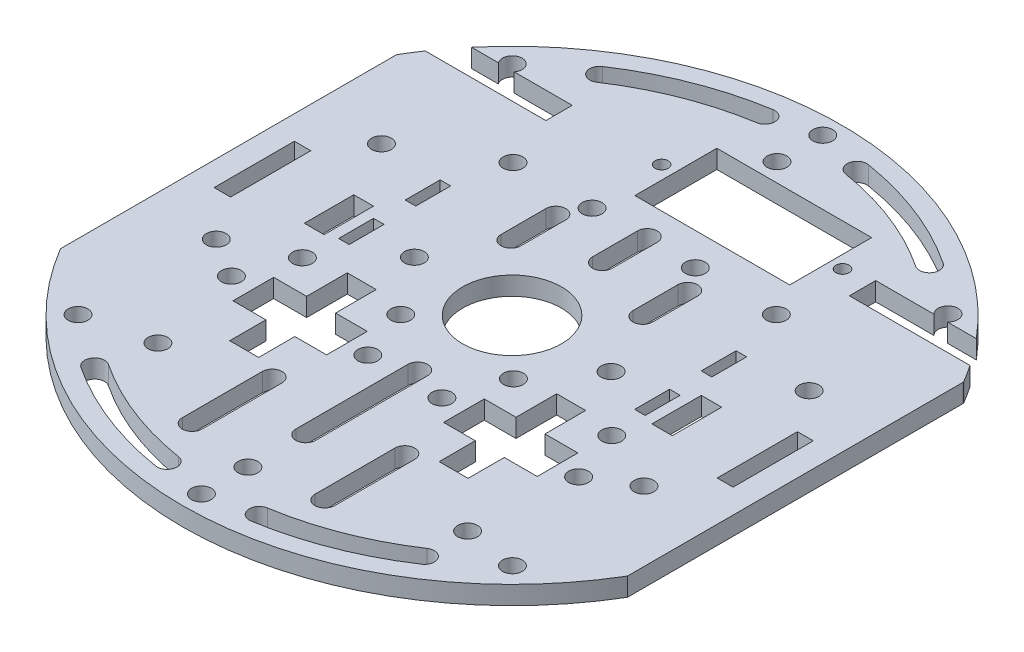
from build123d import *

# Parameters (mm, degrees)
ESQUISSE1_R             = 1.5
ESQUISSE1_W             = 1.6
ESQUISSE1_H             = 5.3
ESQUISSE1_W_2           = 2.5
ESQUISSE1_H_2           = 12.187925894
ESQUISSE1_W_3           = 3
ESQUISSE1_H_3           = 7.5
ESQUISSE1_R_2           = 1
ESQUISSE1_R_3           = 7.5
ESQUISSE1_W_4           = 3.09879963
ESQUISSE1_W_5           = 2.408451493
ESQUISSE1_W_6           = 23.501125708
ESQUISSE1_H_4           = 12.442637558
BOSS_EXTRU_1_DEPTH      = 2.8
ESQUISSE2_W             = 18.3
ESQUISSE2_H             = 4
ENL_V_MAT_EXTRU_1_DEPTH = 10


with BuildPart() as part:
    # Esquisse1 → Boss.-Extru.1 (new body)
    with BuildSketch(Plane(origin=(0, 0, 0), x_dir=(1, 0, 0), z_dir=(0, 1, 0))):
        with BuildLine():
            Line((35.834434648, 167.520022271), (35.834434648, 116.483137771))
            ThreePointArc((35.834434648, 116.483137771), (78.874434648, 91.965268258), (121.914434648, 116.483137771))
            Line((121.914434648, 116.483137771), (121.914434648, 116.551281317))
            Line((121.914434648, 116.551281317), (121.914434648, 167.451878725))
            ThreePointArc((121.914434648, 167.451878725), (121.905555919, 167.517672727), (121.879554918, 167.578759801))
            ThreePointArc((121.879554918, 167.578759801), (78.840278049, 192.037880126), (35.834434648, 167.520022271))
        make_face()
        with Locations(Location((45.826639299, 109.150380711, 0), (0, 0, 270))):
            Circle(ESQUISSE1_R, mode=Mode.SUBTRACT)
        with Locations(Location((55.638558291, 111.468388624, 0), (0, 0, 270))):
            Circle(ESQUISSE1_R, mode=Mode.SUBTRACT)
        with BuildLine():
            ThreePointArc((71.647029759, 95.137737644), (61.941305066, 97.781552096), (53.012507585, 102.414847058))
            ThreePointArc((53.012507585, 102.414847058), (52.590292227, 104.493725167), (54.669170336, 104.915940525))
            ThreePointArc((54.669170336, 104.915940525), (63.032596319, 100.576025821), (72.123754479, 98.099617713))
            ThreePointArc((72.123754479, 98.099617713), (73.366332154, 96.380315319), (71.647029759, 95.137737644))
        make_face(mode=Mode.SUBTRACT)
        with Locations(Location((78.779387596, 94.934167737, 0), (0, 0, 270))):
            Circle(ESQUISSE1_R, mode=Mode.SUBTRACT)
        with Locations(Location((78.779387596, 101.991662508, 0), (0, 0, 270))):
            Circle(ESQUISSE1_R, mode=Mode.SUBTRACT)
        with BuildLine():
            ThreePointArc((67.298661598, 115.661128867), (68.798661598, 117.161128867), (70.298661598, 115.661128867))
            Line((70.298661598, 115.661128867), (70.298661598, 103.507050761))
            ThreePointArc((70.298661598, 103.507050761), (68.798661598, 102.007050761), (67.298661598, 103.507050761))
            Line((67.298661598, 103.507050761), (67.298661598, 115.661128867))
        make_face(mode=Mode.SUBTRACT)
        with Locations(Location((52.421601233, 125.843457604, 0), (0, 0, 270))):
            Circle(ESQUISSE1_R, mode=Mode.SUBTRACT)
        with Locations(Location((46.409268342, 129.560473998, 0), (0, 0, 270))):
            Circle(ESQUISSE1_R, mode=Mode.SUBTRACT)
        with Locations(Location((55.393988642, 133.652108861, 0), (0, 0, 270))):
            Circle(ESQUISSE1_R, mode=Mode.SUBTRACT)
        with Locations((56.403512098, 141.588703433)):
            Rectangle(ESQUISSE1_W, ESQUISSE1_H, mode=Mode.SUBTRACT)
        Polygon((55.777306889, 122.723571348), (55.777306889, 128.903170923), (60.777306889, 128.903170923), (60.777306889, 135.08096829), (65.174368531, 135.08096829), (65.174368531, 128.903170923), (69.992497573, 128.903170923), (69.992497573, 122.723571348), (65.174368531, 122.723571348), (65.174368531, 117.226495279), (60.777306889, 117.226495279), (60.777306889, 122.723571348), align=None, mode=Mode.SUBTRACT)
        with Locations(Location((73.158157676, 125.813371136, 0), (0, 0, 270))):
            Circle(ESQUISSE1_R, mode=Mode.SUBTRACT)
        with Locations(Location((70.317992081, 133.652108861, 0), (0, 0, 270))):
            Circle(ESQUISSE1_R, mode=Mode.SUBTRACT)
        with BuildLine():
            ThreePointArc((103.079698961, 104.915940525), (105.158577069, 104.493725167), (104.736361712, 102.414847058))
            ThreePointArc((104.736361712, 102.414847058), (95.80756423, 97.781552096), (86.101839537, 95.137737644))
            ThreePointArc((86.101839537, 95.137737644), (84.382537143, 96.380315319), (85.625114817, 98.099617713))
            ThreePointArc((85.625114817, 98.099617713), (94.716272977, 100.576025821), (103.079698961, 104.915940525))
        make_face(mode=Mode.SUBTRACT)
        with BuildLine():
            Line((87.432291643, 103.507050761), (87.432291643, 115.661128867))
            ThreePointArc((87.432291643, 115.661128867), (88.932291643, 117.161128867), (90.432291643, 115.661128867))
            Line((90.432291643, 115.661128867), (90.432291643, 103.507050761))
            ThreePointArc((90.432291643, 103.507050761), (88.932291643, 102.007050761), (87.432291643, 103.507050761))
        make_face(mode=Mode.SUBTRACT)
        with Locations(Location((103.866070776, 110.258751266, 0), (0, 0, 270))):
            Circle(ESQUISSE1_R, mode=Mode.SUBTRACT)
        with Locations(Location((111.829584697, 109.103509138, 0), (0, 0, 270))):
            Circle(ESQUISSE1_R, mode=Mode.SUBTRACT)
        with BuildLine():
            ThreePointArc((77.407537365, 127.639089221), (78.907537365, 129.139089221), (80.407537365, 127.639089221))
            Line((80.407537365, 127.639089221), (80.407537365, 110.639089221))
            ThreePointArc((80.407537365, 110.639089221), (78.907537365, 109.139089221), (77.407537365, 110.639089221))
            Line((77.407537365, 110.639089221), (77.407537365, 127.639089221))
        make_face(mode=Mode.SUBTRACT)
        with Locations(Location((84.410371198, 125.813371136, 0), (0, 0, 270))):
            Circle(ESQUISSE1_R, mode=Mode.SUBTRACT)
        Polygon((92.574500765, 135.08096829), (96.971562407, 135.08096829), (96.971562407, 128.903170923), (101.971562407, 128.903170923), (101.971562407, 122.723571348), (96.971562407, 122.723571348), (96.971562407, 117.226495279), (92.574500765, 117.226495279), (92.574500765, 122.723571348), (87.756371724, 122.723571348), (87.756371724, 128.903170923), (92.574500765, 128.903170923), align=None, mode=Mode.SUBTRACT)
        with Locations(Location((87.32715946, 133.757209253, 0), (0, 0, 270))):
            Circle(ESQUISSE1_R, mode=Mode.SUBTRACT)
        with Locations(Location((105.167621672, 125.813371136, 0), (0, 0, 270))):
            Circle(ESQUISSE1_R, mode=Mode.SUBTRACT)
        with Locations(Location((102.25609839, 133.757209253, 0), (0, 0, 270))):
            Circle(ESQUISSE1_R, mode=Mode.SUBTRACT)
        Polygon((102.145357199, 138.938703433), (100.545408567, 138.938687926), (100.545357199, 144.238687926), (102.145357199, 144.238703433), align=None, mode=Mode.SUBTRACT)
        with Locations(Location((111.339600955, 129.560473998, 0), (0, 0, 270))):
            Circle(ESQUISSE1_R, mode=Mode.SUBTRACT)
        with Locations((40.707988868, 142.276611974)):
            Rectangle(ESQUISSE1_W_2, ESQUISSE1_H_2, mode=Mode.SUBTRACT)
        with Locations((52.502940431, 142.090510183)):
            Rectangle(ESQUISSE1_W_3, ESQUISSE1_H_3, mode=Mode.SUBTRACT)
        with Locations((56.403512098, 151.701300531)):
            Rectangle(ESQUISSE1_W, ESQUISSE1_H, mode=Mode.SUBTRACT)
        with Locations(Location((46.409268342, 154.641573871, 0), (0, 0, 270))):
            Circle(ESQUISSE1_R, mode=Mode.SUBTRACT)
        with Locations(Location((63.821984803, 142.221597832, 0), (0, 0, 270))):
            Circle(ESQUISSE1_R, mode=Mode.SUBTRACT)
        with Locations(Location((58.859299527, 162.163285155, 0), (0, 0, 270))):
            Circle(ESQUISSE1_R, mode=Mode.SUBTRACT)
        with BuildLine():
            ThreePointArc((67.405550143, 158.615345539), (68.905550143, 160.115345539), (70.405550143, 158.615345539))
            Line((70.405550143, 158.615345539), (70.405550143, 151.80054615))
            ThreePointArc((70.405550143, 151.80054615), (68.905550143, 150.30054615), (67.405550143, 151.80054615))
            Line((67.405550143, 151.80054615), (67.405550143, 158.615345539))
        make_face(mode=Mode.SUBTRACT)
        with BuildLine():
            ThreePointArc((77.294154599, 162.614914575), (78.794154599, 164.114914575), (80.294154599, 162.614914575))
            Line((80.294154599, 162.614914575), (80.294154599, 155.800115186))
            ThreePointArc((80.294154599, 155.800115186), (78.794154599, 154.300115186), (77.294154599, 155.800115186))
            Line((77.294154599, 155.800115186), (77.294154599, 162.614914575))
        make_face(mode=Mode.SUBTRACT)
        with Locations(Location((70.864412562, 162.163285155, 0), (0, 0, 270))):
            Circle(ESQUISSE1_R, mode=Mode.SUBTRACT)
        with Locations(Location((45.826639299, 175.080590631, 0), (0, 0, 270))):
            Circle(ESQUISSE1_R, mode=Mode.SUBTRACT)
        with Locations(Location((70.405550143, 173.185321498, 0), (0, 0, 270))):
            Circle(ESQUISSE1_R_2, mode=Mode.SUBTRACT)
        with BuildLine():
            ThreePointArc((54.669170336, 179.087219517), (52.590292227, 179.509434875), (53.012507585, 181.588312984))
            ThreePointArc((53.012507585, 181.588312984), (61.941305066, 186.221607946), (71.647029759, 188.865422397))
            ThreePointArc((71.647029759, 188.865422397), (73.366332154, 187.622844723), (72.123754479, 185.903542329))
            ThreePointArc((72.123754479, 185.903542329), (63.032596319, 183.427134221), (54.669170336, 179.087219517))
        make_face(mode=Mode.SUBTRACT)
        with Locations(Location((78.779387596, 182.324270154, 0), (0, 0, 270))):
            Circle(ESQUISSE1_R, mode=Mode.SUBTRACT)
        with Locations(Location((78.779387596, 189.265840996, 0), (0, 0, 270))):
            Circle(ESQUISSE1_R, mode=Mode.SUBTRACT)
        with Locations(Location((78.874434648, 142.001580021, 0), (0, 0, 270))):
            Circle(ESQUISSE1_R_3, mode=Mode.SUBTRACT)
        with Locations(Location((93.783075314, 142.123577455, 0), (0, 0, 270))):
            Circle(ESQUISSE1_R, mode=Mode.SUBTRACT)
        with BuildLine():
            Line((87.432291643, 151.80054615), (87.432291643, 158.615345539))
            ThreePointArc((87.432291643, 158.615345539), (88.932291643, 160.115345539), (90.432291643, 158.615345539))
            Line((90.432291643, 158.615345539), (90.432291643, 151.80054615))
            ThreePointArc((90.432291643, 151.80054615), (88.932291643, 150.30054615), (87.432291643, 151.80054615))
        make_face(mode=Mode.SUBTRACT)
        with Locations(Location((86.533099498, 162.163285155, 0), (0, 0, 270))):
            Circle(ESQUISSE1_R, mode=Mode.SUBTRACT)
        with Locations(Location((98.837943517, 162.163285155, 0), (0, 0, 270))):
            Circle(ESQUISSE1_R, mode=Mode.SUBTRACT)
        with Locations((105.316670961, 142.090510183)):
            Rectangle(ESQUISSE1_W_4, ESQUISSE1_H_3, mode=Mode.SUBTRACT)
        Polygon((102.145357199, 149.055077174), (100.545310556, 149.05129834), (100.545259188, 154.351313005), (102.145357199, 154.355091961), align=None, mode=Mode.SUBTRACT)
        with Locations((117.040821997, 142.276611974)):
            Rectangle(ESQUISSE1_W_5, ESQUISSE1_H_2, mode=Mode.SUBTRACT)
        with Locations(Location((111.339600955, 154.641573871, 0), (0, 0, 270))):
            Circle(ESQUISSE1_R, mode=Mode.SUBTRACT)
        with Locations((84.201914375, 173.296740459)):
            Rectangle(ESQUISSE1_W_6, ESQUISSE1_H_4, mode=Mode.SUBTRACT)
        with Locations(Location((97.864345109, 173.185321498, 0), (0, 0, 270))):
            Circle(ESQUISSE1_R_2, mode=Mode.SUBTRACT)
        with BuildLine():
            ThreePointArc((86.101839537, 188.865422397), (95.80756423, 186.221607946), (104.736361712, 181.588312984))
            ThreePointArc((104.736361712, 181.588312984), (105.158577069, 179.509434875), (103.079698961, 179.087219517))
            ThreePointArc((103.079698961, 179.087219517), (94.716272977, 183.427134221), (85.625114817, 185.903542329))
            ThreePointArc((85.625114817, 185.903542329), (84.382537143, 187.622844723), (86.101839537, 188.865422397))
        make_face(mode=Mode.SUBTRACT)
        with Locations(Location((111.789066553, 175.276830964, 0), (0, 0, 270))):
            Circle(ESQUISSE1_R, mode=Mode.SUBTRACT)
    extrude(amount=BOSS_EXTRU_1_DEPTH)

    # Esquisse2 → Enlèv. mat.-Extru.1 (cut)
    with BuildSketch(Plane(origin=(0, 0, 0), x_dir=(-1, 0, 0), z_dir=(0, -1, 0))):
        with Locations((-111.064434648, 172.178759801)):
            Rectangle(ESQUISSE2_W, ESQUISSE2_H)
        with Locations((-46.684434648, 172.178759801)):
            Rectangle(ESQUISSE2_W, ESQUISSE2_H)
    extrude(amount=-ENL_V_MAT_EXTRU_1_DEPTH, mode=Mode.SUBTRACT)


solid = part.part
